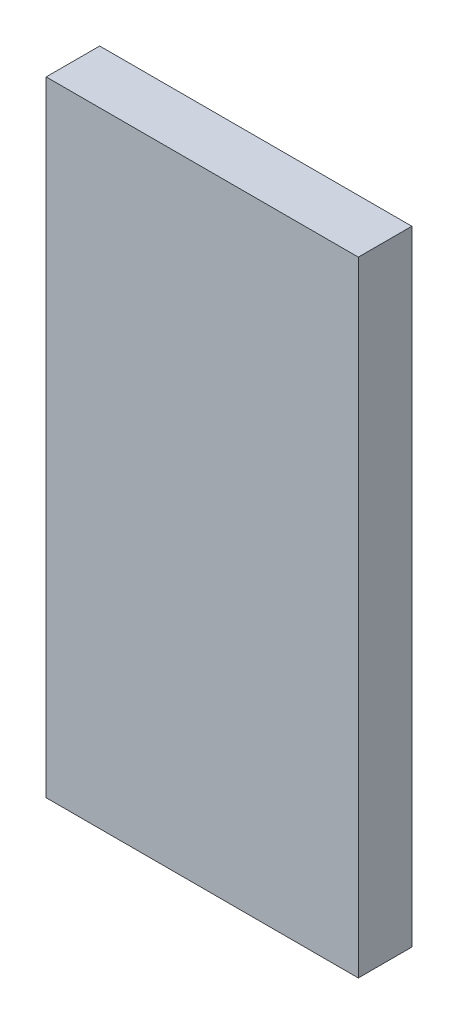
from build123d import *

# Parameters (mm, degrees)
SKETCH1_W           = 35
SKETCH1_H           = 70
BOSS_EXTRUDE1_DEPTH = 6


with BuildPart() as part:
    # Sketch1 → Boss-Extrude1 (new body)
    with BuildSketch(Plane.XY):
        with Locations((17.5, 35)):
            Rectangle(SKETCH1_W, SKETCH1_H)
    extrude(amount=BOSS_EXTRUDE1_DEPTH)


solid = part.part
